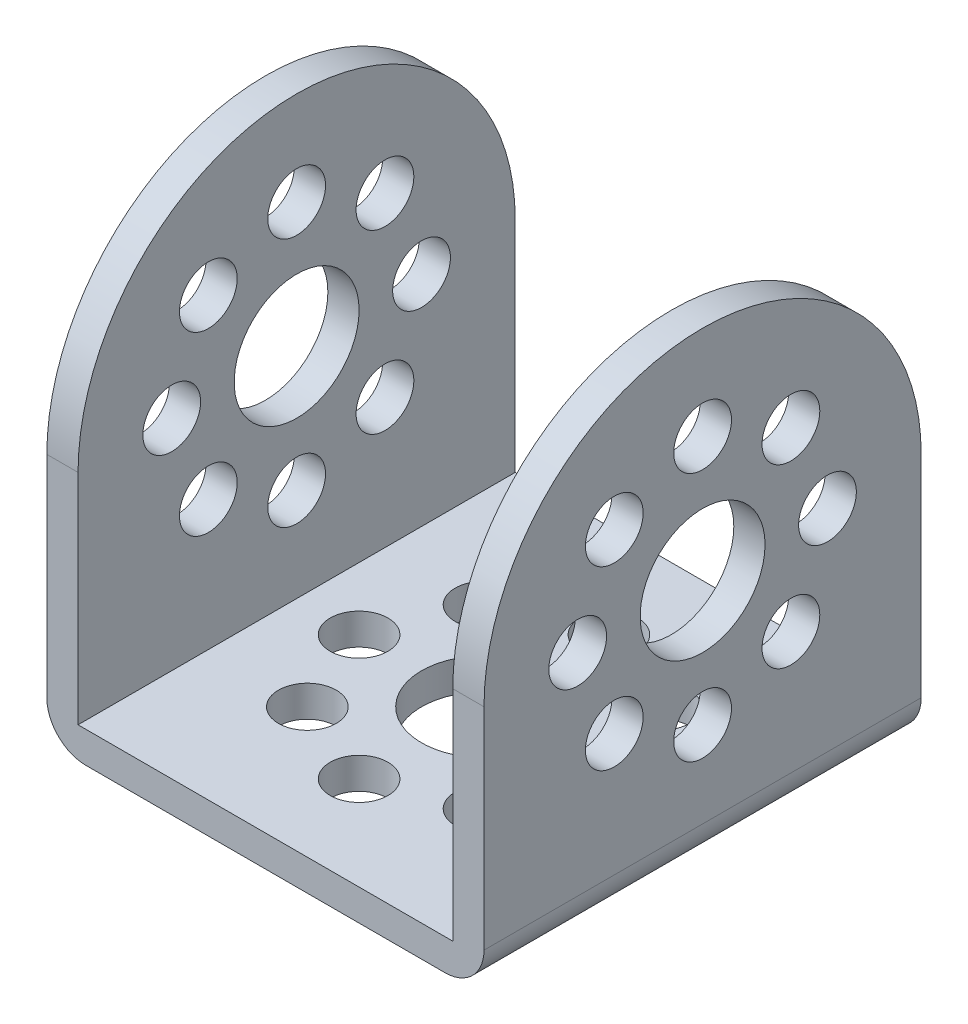
from build123d import *

# Parameters (mm, degrees)
BOSS_EXTRUDE1_DEPTH      = 14
BOSS_EXTRUDE1_DEPTH_BACK = 14
SKETCH1_R                = 4
SKETCH1_R_2              = 1.85
CUT_EXTRUDE1_DEPTH       = 12
CUT_EXTRUDE1_DEPTH_BACK  = 12
SKETCH3_R                = 4
SKETCH3_R_2              = 1.85
CUT_EXTRUDE2_DEPTH       = 2
FILLET1_R                = 2.5


with BuildPart() as part:
    # Sketch1 → Boss-Extrude1 (new, two sides: drawn at the far end of the back side and taken through both)
    with BuildSketch(Plane(origin=(0, 0, 0), x_dir=(0, 0, -1), z_dir=(1, 0, 0)).offset(-BOSS_EXTRUDE1_DEPTH_BACK)):
        with BuildLine():
            Line((-14, 0), (-14, -16))
            Line((-14, -16), (14, -16))
            Line((14, -16), (14, 0))
            ThreePointArc((14, 0), (0, 14), (-14, 0))
        make_face()
        Circle(SKETCH1_R, mode=Mode.SUBTRACT)
        with Locations((0, 8)):
            Circle(SKETCH1_R_2, mode=Mode.SUBTRACT)
        with Locations((5.656854249, 5.656854249)):
            Circle(SKETCH1_R_2, mode=Mode.SUBTRACT)
        with Locations((8, 0)):
            Circle(SKETCH1_R_2, mode=Mode.SUBTRACT)
        with Locations((5.656854249, -5.656854249)):
            Circle(SKETCH1_R_2, mode=Mode.SUBTRACT)
        with Locations((0, -8)):
            Circle(SKETCH1_R_2, mode=Mode.SUBTRACT)
        with Locations((-5.656854249, -5.656854249)):
            Circle(SKETCH1_R_2, mode=Mode.SUBTRACT)
        with Locations((-8, 0)):
            Circle(SKETCH1_R_2, mode=Mode.SUBTRACT)
        with Locations((-5.656854249, 5.656854249)):
            Circle(SKETCH1_R_2, mode=Mode.SUBTRACT)
    extrude(amount=BOSS_EXTRUDE1_DEPTH + BOSS_EXTRUDE1_DEPTH_BACK)

    # Sketch2 → Cut-Extrude1 (cut, two sides: drawn at the far end of the back side and taken through both)
    with BuildSketch(Plane(origin=(0, 0, 0), x_dir=(0, 0, -1), z_dir=(1, 0, 0)).offset(-CUT_EXTRUDE1_DEPTH_BACK)):
        with BuildLine():
            Line((-14, 0), (-14, -14))
            Line((-14, -14), (14, -14))
            Line((14, -14), (14, 0))
            ThreePointArc((14, 0), (0, 14), (-14, 0))
        make_face()
    extrude(amount=CUT_EXTRUDE1_DEPTH + CUT_EXTRUDE1_DEPTH_BACK, mode=Mode.SUBTRACT)

    # Sketch3 → Cut-Extrude2 (cut)
    with BuildSketch(Plane.XZ.offset(16)):
        with Locations(Location((0, 0, 0), (0, 0, 270))):
            Circle(SKETCH3_R)
        with Locations(Location((0, 8, 0), (0, 0, 270))):
            Circle(SKETCH3_R_2)
        with Locations(Location((5.656854249, 5.656854249, 0), (0, 0, 270))):
            Circle(SKETCH3_R_2)
        with Locations(Location((8, 0, 0), (0, 0, 270))):
            Circle(SKETCH3_R_2)
        with Locations(Location((5.656854249, -5.656854249, 0), (0, 0, 270))):
            Circle(SKETCH3_R_2)
        with Locations(Location((0, -8, 0), (0, 0, 270))):
            Circle(SKETCH3_R_2)
        with Locations(Location((-5.656854249, -5.656854249, 0), (0, 0, 270))):
            Circle(SKETCH3_R_2)
        with Locations(Location((-8, 0, 0), (0, 0, 270))):
            Circle(SKETCH3_R_2)
        with Locations(Location((-5.656854249, 5.656854249, 0), (0, 0, 270))):
            Circle(SKETCH3_R_2)
    extrude(amount=-CUT_EXTRUDE2_DEPTH, mode=Mode.SUBTRACT)

    # Fillet1
    fillet1_edges = [part.edges().sort_by_distance(p)[0] for p in [
        (-14, -16, 0),
        (14, -16, 0),
    ]]
    fillet(fillet1_edges, radius=FILLET1_R)


solid = part.part
